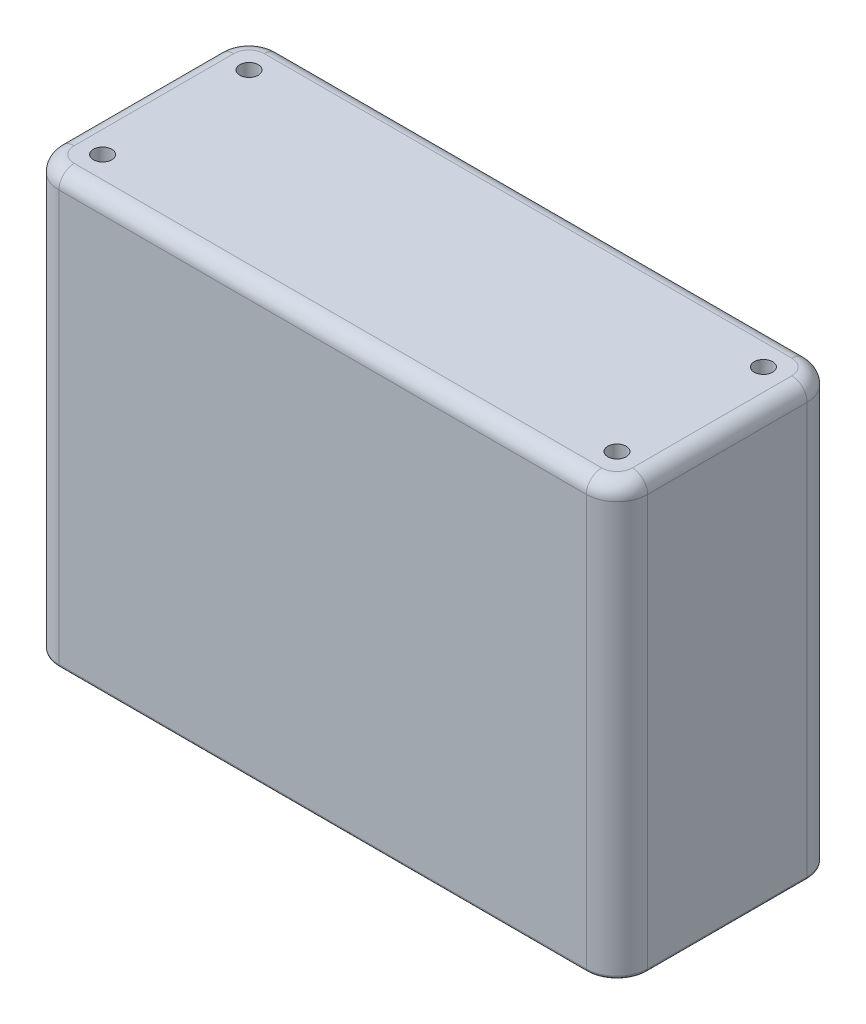
from build123d import *

# Parameters (mm, degrees)
BOSS_EXTRUDE1_DEPTH = 60
BOSS_EXTRUDE2_DEPTH = 10
FILLET1_R           = 2.5
FILLET2_R           = 0.5
SKETCH7_R           = 1.5
CUT_EXTRUDE1_DEPTH  = 10


with BuildPart() as part:
    # Sketch1 → Boss-Extrude1 (new body)
    with BuildSketch(Plane(origin=(0, 0, 0), x_dir=(1, 0, 0), z_dir=(0, 1, 0))):
        with BuildLine():
            Line((-43, 10.447552448), (43, 10.447552448))
            ThreePointArc((43, 10.447552448), (46.535533906, 8.983086353), (48, 5.447552448))
            Line((48, 5.447552448), (48, -20.552447552))
            ThreePointArc((48, -20.552447552), (46.535533906, -24.087981458), (43, -25.552447552))
            Line((43, -25.552447552), (-43, -25.552447552))
            ThreePointArc((-43, -25.552447552), (-46.535533906, -24.087981458), (-48, -20.552447552))
            Line((-48, -20.552447552), (-48, 5.447552448))
            ThreePointArc((-48, 5.447552448), (-46.535533906, 8.983086353), (-43, 10.447552448))
        make_face()
        with BuildLine():
            Line((-43, 7.447552448), (43, 7.447552448))
            ThreePointArc((43, 7.447552448), (44.414213562, 6.86176601), (45, 5.447552448))
            Line((45, 5.447552448), (45, -20.552447552))
            ThreePointArc((45, -20.552447552), (44.414213562, -21.966661115), (43, -22.552447552))
            Line((43, -22.552447552), (-43, -22.552447552))
            ThreePointArc((-43, -22.552447552), (-44.414213562, -21.966661115), (-45, -20.552447552))
            Line((-45, -20.552447552), (-45, 5.447552448))
            ThreePointArc((-45, 5.447552448), (-44.414213562, 6.86176601), (-43, 7.447552448))
        make_face(mode=Mode.SUBTRACT)
    extrude(amount=BOSS_EXTRUDE1_DEPTH)

    # Sketch2 → Boss-Extrude2 (add)
    with BuildSketch(Plane(origin=(0, 60, 0), x_dir=(1, 0, 0), z_dir=(0, 1, 0))):
        with BuildLine():
            Line((-43, -25.552447552), (43, -25.552447552))
            ThreePointArc((43, -25.552447552), (46.535533906, -24.087981458), (48, -20.552447552))
            Line((48, -20.552447552), (48, 5.447552448))
            ThreePointArc((48, 5.447552448), (46.535533906, 8.983086353), (43, 10.447552448))
            Line((43, 10.447552448), (-43, 10.447552448))
            ThreePointArc((-43, 10.447552448), (-46.535533906, 8.983086353), (-48, 5.447552448))
            Line((-48, 5.447552448), (-48, -20.552447552))
            ThreePointArc((-48, -20.552447552), (-46.535533906, -24.087981458), (-43, -25.552447552))
        make_face()
    extrude(amount=BOSS_EXTRUDE2_DEPTH)

    # Fillet1
    fillet1_edges = [part.edges().sort_by_distance(p)[0] for p in [
        (46.535533906, 70, 24.087981458),
        (48, 70, 7.552447552),
        (46.535533906, 70, -8.983086353),
        (-46.535533906, 70, -8.983086353),
        (0, 70, -10.447552448),
        (-48, 70, 7.552447552),
        (-46.535533906, 70, 24.087981458),
        (0, 70, 25.552447552),
    ]]
    fillet(fillet1_edges, radius=FILLET1_R)

    # Fillet2
    fillet2_edges = [part.edges().sort_by_distance(p)[0] for p in [
        (0, 0, -7.447552448),
        (44.414213562, 0, -6.86176601),
        (45, 0, 7.552447552),
        (44.414213562, 0, 21.966661115),
        (0, 0, 22.552447552),
        (-44.414213562, 0, 21.966661115),
        (-45, 0, 7.552447552),
        (-44.414213562, 0, -6.86176601),
        (0, 0, 25.552447552),
        (46.535533906, 0, 24.087981458),
        (48, 0, 7.552447552),
        (46.535533906, 0, -8.983086353),
        (0, 0, -10.447552448),
        (-46.535533906, 0, -8.983086353),
        (-48, 0, 7.552447552),
        (-46.535533906, 0, 24.087981458),
    ]]
    fillet(fillet2_edges, radius=FILLET2_R)

    # Sketch7 → Cut-Extrude1 (cut)
    with BuildSketch(Plane(origin=(0, 70, 0), x_dir=(1, 0, 0), z_dir=(0, 1, 0))):
        with Locations((-41.939339828, 4.386892276)):
            Circle(SKETCH7_R)
        with Locations((-41.939339828, -19.491787381)):
            Circle(SKETCH7_R)
        with Locations((41.939339828, -19.491787381)):
            Circle(SKETCH7_R)
        with Locations((41.939339828, 4.386892276)):
            Circle(SKETCH7_R)
    extrude(amount=-CUT_EXTRUDE1_DEPTH, mode=Mode.SUBTRACT)


solid = part.part
